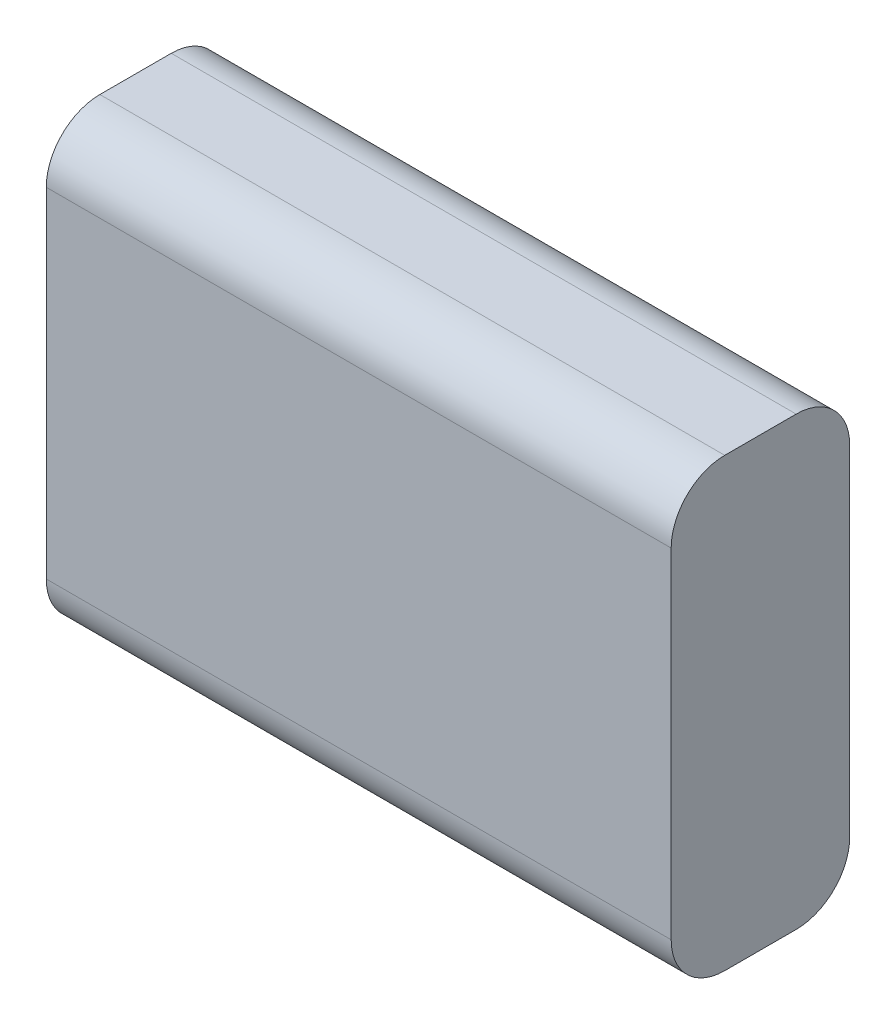
from build123d import *

# Parameters (mm, degrees)
SKETCH1_W           = 35
SKETCH1_H           = 25
BOSS_EXTRUDE1_DEPTH = 10
FILLET1_R           = 3


with BuildPart() as part:
    # Sketch1 → Boss-Extrude1 (new body)
    with BuildSketch(Plane.XY):
        with Locations((17.5, 12.5)):
            Rectangle(SKETCH1_W, SKETCH1_H)
    extrude(amount=BOSS_EXTRUDE1_DEPTH)

    # Fillet1
    fillet1_edges = [part.edges().sort_by_distance(p)[0] for p in [
        (17.5, 25, 10),
        (17.5, 25, 0),
        (17.5, 0, 0),
        (17.5, 0, 10),
    ]]
    fillet(fillet1_edges, radius=FILLET1_R)


solid = part.part
